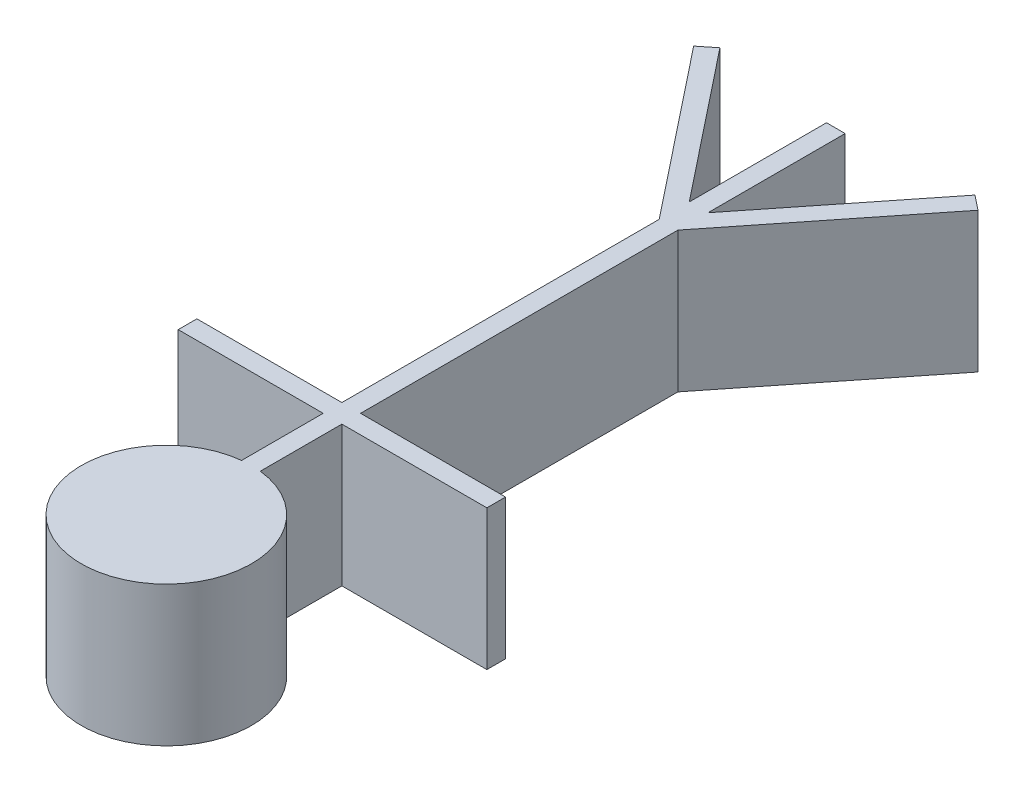
from build123d import *

# Parameters (mm, degrees)
BOSS_EXTRUDE1_DEPTH = 30


with BuildPart() as part:
    # Sketch1 → Boss-Extrude1 (new body)
    with BuildSketch(Plane(origin=(0, 0, 0), x_dir=(1, 0, 0), z_dir=(0, 1, 0))):
        with BuildLine():
            Line((2, -107.749471884), (33.038610535, -107.749471884))
            Line((33.038610535, -107.749471884), (33.038610535, -103.749471884))
            Line((33.038610535, -103.749471884), (2, -103.749471884))
            Line((2, -103.749471884), (2, -35.811953605))
            Line((2, -35.811953605), (30.435409652, 0))
            Line((30.435409652, 0), (27.302817395, 2.487341101))
            Line((27.302817395, 2.487341101), (2, -29.379381894))
            Line((2, -29.379381894), (2, 0))
            Line((2, 0), (-2, 0))
            Line((-2, 0), (-2, -29.379381894))
            Line((-2, -29.379381894), (-27.302817395, 2.487341101))
            Line((-27.302817395, 2.487341101), (-30.435409652, 0))
            Line((-30.435409652, 0), (-2, -35.811953605))
            Line((-2, -35.811953605), (-2, -103.749471884))
            Line((-2, -103.749471884), (-33.038610535, -103.749471884))
            Line((-33.038610535, -103.749471884), (-33.038610535, -107.749471884))
            Line((-33.038610535, -107.749471884), (-2, -107.749471884))
            Line((-2, -107.749471884), (-2, -125.214231971))
            ThreePointArc((-2, -125.214231971), (0, -161.548956818), (2, -125.214231971))
            Line((2, -125.214231971), (2, -107.749471884))
        make_face()
    extrude(amount=BOSS_EXTRUDE1_DEPTH)


solid = part.part
